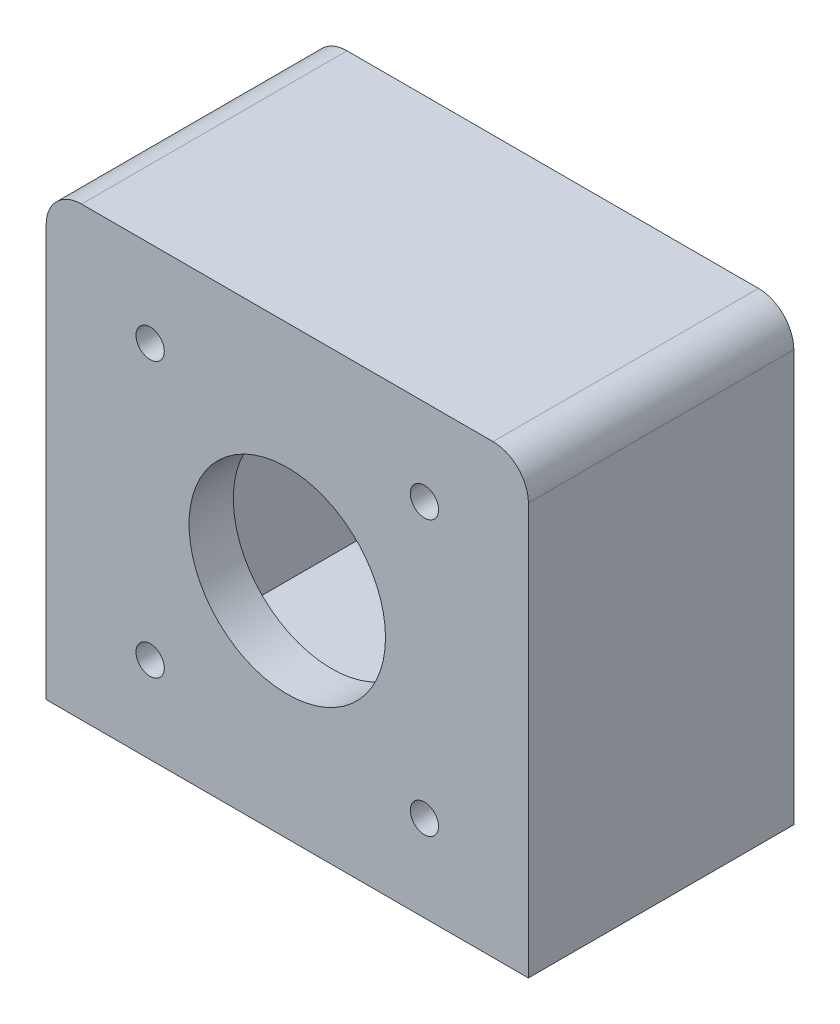
from build123d import *

# Parameters (mm, degrees)
SKETCH1_W           = 50.5
SKETCH1_H           = 50.5
SKETCH1_W_2         = 42.5
SKETCH1_H_2         = 42.5
BOSS_EXTRUDE1_DEPTH = 25
SKETCH3_W           = 50.5
SKETCH3_H           = 50.5
SKETCH3_R           = 11.1
SKETCH3_R_2         = 1.6
BOSS_EXTRUDE2_DEPTH = 5
SKETCH6_W           = 30
SKETCH6_H           = 50.5
BOSS_EXTRUDE3_DEPTH = 2
SKETCH7_W           = 30
SKETCH7_H           = 50.5
BOSS_EXTRUDE4_DEPTH = 2
SKETCH5_R           = 1.95
CUT_EXTRUDE1_DEPTH  = 5.7
CUT_EXTRUDE2_DEPTH  = 48.750654446


with BuildPart() as part:
    # Sketch1 → Boss-Extrude1 (new body)
    with BuildSketch(Plane.XY):
        Rectangle(SKETCH1_W, SKETCH1_H)
        Rectangle(SKETCH1_W_2, SKETCH1_H_2, mode=Mode.SUBTRACT)
    extrude(amount=BOSS_EXTRUDE1_DEPTH)

    # Sketch3 → Boss-Extrude2 (add)
    with BuildSketch(Plane.XY.offset(25)):
        Rectangle(SKETCH3_W, SKETCH3_H)
        Circle(SKETCH3_R, mode=Mode.SUBTRACT)
        with Locations((-15.5, 15.5)):
            Circle(SKETCH3_R_2, mode=Mode.SUBTRACT)
        with Locations((15.5, 15.5)):
            Circle(SKETCH3_R_2, mode=Mode.SUBTRACT)
        with Locations((15.5, -15.5)):
            Circle(SKETCH3_R_2, mode=Mode.SUBTRACT)
        with Locations((-15.5, -15.5)):
            Circle(SKETCH3_R_2, mode=Mode.SUBTRACT)
    extrude(amount=BOSS_EXTRUDE2_DEPTH)

    # Sketch6 → Boss-Extrude3 (add)
    with BuildSketch(Plane.ZY.offset(25.25)):
        with Locations((15, 0)):
            Rectangle(SKETCH6_W, SKETCH6_H)
    extrude(amount=BOSS_EXTRUDE3_DEPTH)

    # Sketch7 → Boss-Extrude4 (add)
    with BuildSketch(Plane(origin=(25.25, 0, 0), x_dir=(0, 0, -1), z_dir=(1, 0, 0))):
        with Locations((-15, 0)):
            Rectangle(SKETCH7_W, SKETCH7_H)
    extrude(amount=BOSS_EXTRUDE4_DEPTH)

    # Sketch5 → Cut-Extrude1 (cut)
    with BuildSketch(Plane(origin=(0, -27.3, 0), x_dir=(-1, 0, 0), z_dir=(0, -1, 0))):
        with Locations(Location((-24.25, -3, 0), (0, 0, 180))):
            Circle(SKETCH5_R)
        with Locations(Location((24.25, -3, 0), (0, 0, 270))):
            Circle(SKETCH5_R)
        with Locations(Location((24.25, -27, 0), (0, 0, 180))):
            Circle(SKETCH5_R)
        with Locations(Location((-24.25, -27, 0), (0, 0, 270))):
            Circle(SKETCH5_R)
    extrude(amount=-CUT_EXTRUDE1_DEPTH, mode=Mode.SUBTRACT)

    # Sketch8 → Cut-Extrude2 (cut, through all)
    with BuildSketch(Plane(origin=(0, 0, 0), x_dir=(-1, 0, 0), z_dir=(0, 0, -1))):
        with BuildLine():
            Line((27.25, 25.25), (23.25, 25.25))
            ThreePointArc((23.25, 25.25), (26.078427125, 24.078427125), (27.25, 21.25))
            Line((27.25, 21.25), (27.25, 25.25))
        make_face()
        with BuildLine():
            ThreePointArc((-27.25, 21.25), (-26.078427125, 24.078427125), (-23.25, 25.25))
            Line((-23.25, 25.25), (-27.25, 25.25))
            Line((-27.25, 25.25), (-27.25, 21.25))
        make_face()
    extrude(amount=-CUT_EXTRUDE2_DEPTH, mode=Mode.SUBTRACT)


solid = part.part
